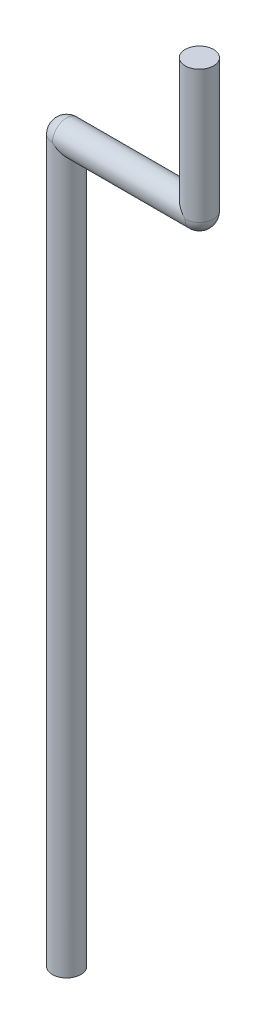
from build123d import *

# Parameters (mm, degrees)
SKETCH_1_R      = 0.75
EXTRUDE_1_DEPTH = 38
SKETCH_3_R      = 0.75
EXTRUDE_2_DEPTH = 7
SKETCH_5_R      = 0.75
EXTRUDE_3_DEPTH = 7


with BuildPart() as part:
    # 草图1 → 凸台-拉伸1 (new body)
    with BuildSketch(Plane(origin=(0, 0, 0), x_dir=(1, 0, 0), z_dir=(0, 1, 0))):
        with Locations(Location((0, 0, 0), (0, 0, 270))):
            Circle(SKETCH_1_R)
    extrude(amount=EXTRUDE_1_DEPTH)

    # 草图2 → 旋转1 (revolve)
    with BuildSketch(Plane.XY):
        with BuildLine():
            Line((0, 38.75), (0, 37.25))
            ThreePointArc((0, 37.25), (0.75, 38), (0, 38.75))
        make_face()
    revolve(axis=Axis((0, 38.75, 0), (0, -1, 0)))

    # 草图3 → 凸台-拉伸2 (add)
    with BuildSketch(Plane(origin=(0, 0, 0), x_dir=(0, 0, -1), z_dir=(1, 0, 0))):
        with Locations((0, 38)):
            Circle(SKETCH_3_R)
    extrude(amount=EXTRUDE_2_DEPTH)

    # 草图4 → 旋转2 (revolve)
    with BuildSketch(Plane(origin=(7, 0, 0), x_dir=(0, 0, -1), z_dir=(1, 0, 0))):
        with BuildLine():
            Line((0, 38.75), (0, 37.25))
            ThreePointArc((0, 37.25), (0.75, 38), (0, 38.75))
        make_face()
    revolve(axis=Axis((7, 38.75, 0), (0, -1, 0)))

    # 草图5 → 凸台-拉伸3 (add)
    with BuildSketch(Plane(origin=(0, 38, 0), x_dir=(1, 0, 0), z_dir=(0, 1, 0))):
        with Locations(Location((7, 0, 0), (0, 0, 270))):
            Circle(SKETCH_5_R)
    extrude(amount=EXTRUDE_3_DEPTH)


solid = part.part
